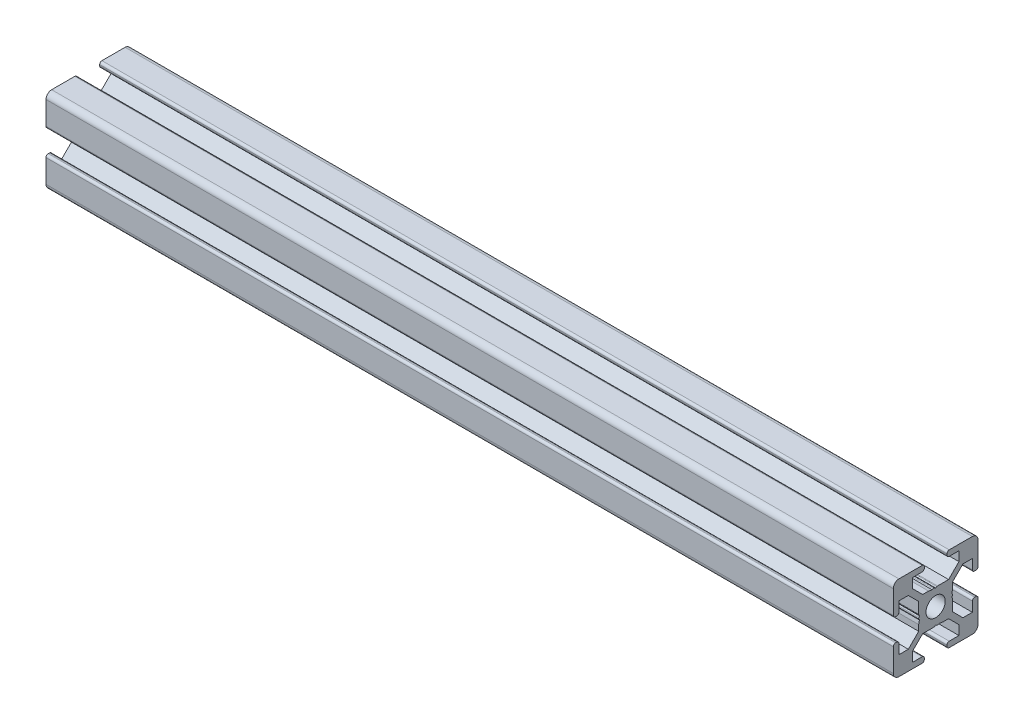
from build123d import *

# Parameters (mm, degrees)
SKETCH_1_R             = 3.4
F_30_X_30_X_R2_2_DEPTH = 300


with BuildPart() as part:
    # 草图1 → 铝型材 30 X 30 X R2(2) (new body)
    with BuildSketch(Plane(origin=(-150, 0, 0), x_dir=(0, 0, -1), z_dir=(1, 0, 0))):
        with BuildLine():
            Line((-15, -4.8), (-15, -13))
            ThreePointArc((-15, -13), (-14.414213562, -14.414213562), (-13, -15))
            Line((-13, -15), (-4.8, -15))
            ThreePointArc((-4.8, -15), (-4.234314575, -14.765685425), (-4, -14.2))
            Line((-4, -14.2), (-4, -13.8))
            ThreePointArc((-4, -13.8), (-4.234314575, -13.234314575), (-4.8, -13))
            Line((-4.8, -13), (-8.25, -13))
            Line((-8.25, -13), (-8.25, -9.664213562))
            Line((-8.25, -9.664213562), (-4.585786438, -6))
            Line((-4.585786438, -6), (-0.653589838, -6))
            ThreePointArc((-0.653589838, -6), (-0.524180316, -5.982962913), (-0.403589838, -5.933012702))
            Line((-0.403589838, -5.933012702), (0, -5.7))
            Line((0, -5.7), (0.403589838, -5.933012702))
            ThreePointArc((0.403589838, -5.933012702), (0.653589838, -6), (0.903589838, -5.933012702))
            Line((0.903589838, -5.933012702), (1.218885629, -5.750976592))
            Line((1.218885629, -5.750976592), (2.5, -6))
            Line((2.5, -6), (4.585786438, -6))
            Line((4.585786438, -6), (8.25, -9.664213562))
            Line((8.25, -9.664213562), (8.25, -13))
            Line((8.25, -13), (4.8, -13))
            ThreePointArc((4.8, -13), (4.234314575, -13.234314575), (4, -13.8))
            Line((4, -13.8), (4, -14.2))
            ThreePointArc((4, -14.2), (4.234314575, -14.765685425), (4.8, -15))
            Line((4.8, -15), (13, -15))
            ThreePointArc((13, -15), (14.414213562, -14.414213562), (15, -13))
            Line((15, -13), (15, -4.8))
            ThreePointArc((15, -4.8), (14.765685425, -4.234314575), (14.2, -4))
            Line((14.2, -4), (13.8, -4))
            ThreePointArc((13.8, -4), (13.234314575, -4.234314575), (13, -4.8))
            Line((13, -4.8), (13, -8.25))
            Line((13, -8.25), (9.664213562, -8.25))
            Line((9.664213562, -8.25), (6, -4.585786438))
            Line((6, -4.585786438), (6, -0.653589838))
            ThreePointArc((6, -0.653589838), (5.982962913, -0.524180316), (5.933012702, -0.403589838))
            Line((5.933012702, -0.403589838), (5.7, 0))
            Line((5.7, 0), (5.933012702, 0.403589838))
            ThreePointArc((5.933012702, 0.403589838), (6, 0.653589838), (5.933012702, 0.903589838))
            Line((5.933012702, 0.903589838), (5.750976592, 1.218885629))
            Line((5.750976592, 1.218885629), (6, 2.5))
            Line((6, 2.5), (6, 4.585786438))
            Line((6, 4.585786438), (9.664213562, 8.25))
            Line((9.664213562, 8.25), (13, 8.25))
            Line((13, 8.25), (13, 4.8))
            ThreePointArc((13, 4.8), (13.234314575, 4.234314575), (13.8, 4))
            Line((13.8, 4), (14.2, 4))
            ThreePointArc((14.2, 4), (14.765685425, 4.234314575), (15, 4.8))
            Line((15, 4.8), (15, 13))
            ThreePointArc((15, 13), (14.414213562, 14.414213562), (13, 15))
            Line((13, 15), (4.8, 15))
            ThreePointArc((4.8, 15), (4.234314575, 14.765685425), (4, 14.2))
            Line((4, 14.2), (4, 13.8))
            ThreePointArc((4, 13.8), (4.234314575, 13.234314575), (4.8, 13))
            Line((4.8, 13), (8.25, 13))
            Line((8.25, 13), (8.25, 9.664213562))
            Line((8.25, 9.664213562), (4.585786438, 6))
            Line((4.585786438, 6), (0.653589838, 6))
            ThreePointArc((0.653589838, 6), (0.524180316, 5.982962913), (0.403589838, 5.933012702))
            Line((0.403589838, 5.933012702), (0, 5.7))
            Line((0, 5.7), (-0.403589838, 5.933012702))
            ThreePointArc((-0.403589838, 5.933012702), (-0.653589838, 6), (-0.903589838, 5.933012702))
            Line((-0.903589838, 5.933012702), (-1.218885629, 5.750976592))
            Line((-1.218885629, 5.750976592), (-2.5, 6))
            Line((-2.5, 6), (-4.585786438, 6))
            Line((-4.585786438, 6), (-8.25, 9.664213562))
            Line((-8.25, 9.664213562), (-8.25, 13))
            Line((-8.25, 13), (-4.8, 13))
            ThreePointArc((-4.8, 13), (-4.234314575, 13.234314575), (-4, 13.8))
            Line((-4, 13.8), (-4, 14.2))
            ThreePointArc((-4, 14.2), (-4.234314575, 14.765685425), (-4.8, 15))
            Line((-4.8, 15), (-13, 15))
            ThreePointArc((-13, 15), (-14.414213562, 14.414213562), (-15, 13))
            Line((-15, 13), (-15, 4.8))
            ThreePointArc((-15, 4.8), (-14.765685425, 4.234314575), (-14.2, 4))
            Line((-14.2, 4), (-13.8, 4))
            ThreePointArc((-13.8, 4), (-13.234314575, 4.234314575), (-13, 4.8))
            Line((-13, 4.8), (-13, 8.25))
            Line((-13, 8.25), (-9.664213562, 8.25))
            Line((-9.664213562, 8.25), (-6, 4.585786438))
            Line((-6, 4.585786438), (-6, 0.653589838))
            ThreePointArc((-6, 0.653589838), (-5.982962913, 0.524180316), (-5.933012702, 0.403589838))
            Line((-5.933012702, 0.403589838), (-5.7, 0))
            Line((-5.7, 0), (-5.933012702, -0.403589838))
            ThreePointArc((-5.933012702, -0.403589838), (-6, -0.653589838), (-5.933012702, -0.903589838))
            Line((-5.933012702, -0.903589838), (-5.750976592, -1.218885629))
            Line((-5.750976592, -1.218885629), (-6, -2.5))
            Line((-6, -2.5), (-6, -4.585786438))
            Line((-6, -4.585786438), (-9.664213562, -8.25))
            Line((-9.664213562, -8.25), (-13, -8.25))
            Line((-13, -8.25), (-13, -4.8))
            ThreePointArc((-13, -4.8), (-13.234314575, -4.234314575), (-13.8, -4))
            Line((-13.8, -4), (-14.2, -4))
            ThreePointArc((-14.2, -4), (-14.765685425, -4.234314575), (-15, -4.8))
        make_face()
        Circle(SKETCH_1_R, mode=Mode.SUBTRACT)
    extrude(amount=F_30_X_30_X_R2_2_DEPTH)


solid = part.part
